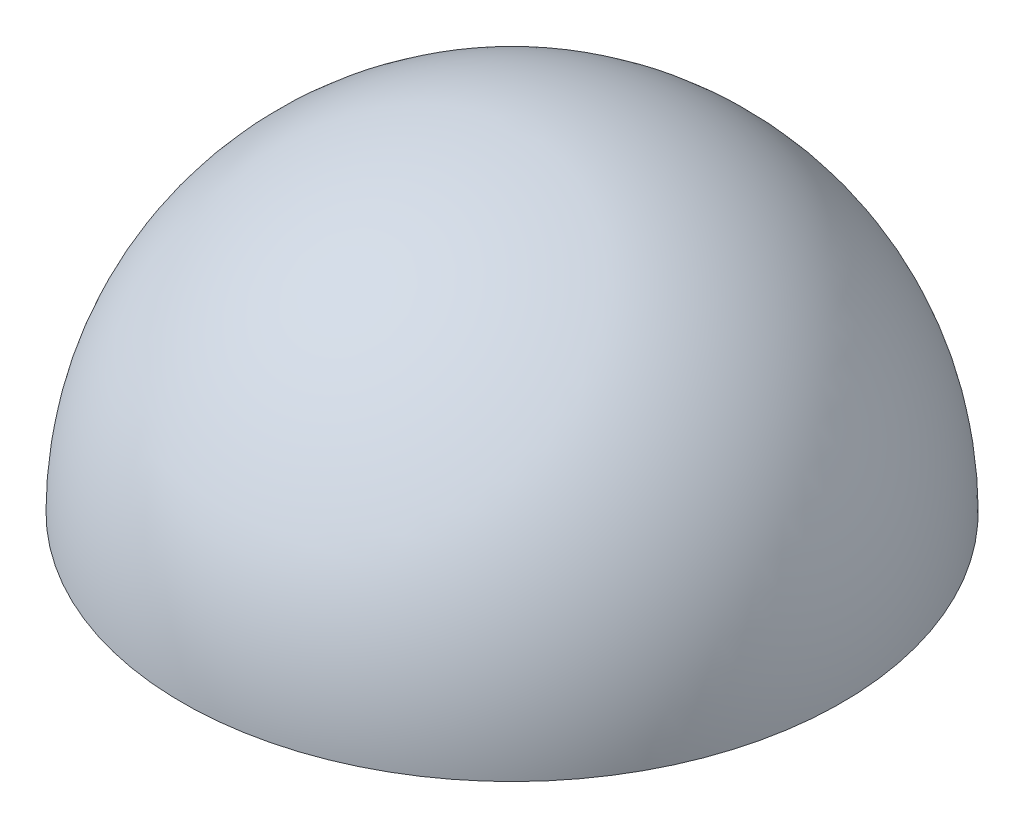
from build123d import *

# Parameters (mm, degrees)
REVOLVE1_ANGLE = 180


with BuildPart() as part:
    # Sketch1 → Revolve1 (revolve)
    with BuildSketch(Plane(origin=(0, 0, 0), x_dir=(1, 0, 0), z_dir=(0, 1, 0))):
        with BuildLine():
            Line((-50.8, 0), (50.8, 0))
            ThreePointArc((50.8, 0), (0, 50.8), (-50.8, 0))
        make_face()
    revolve(axis=Axis((-50.8, 0, 0), (1, 0, 0)), revolution_arc=REVOLVE1_ANGLE)


solid = part.part
